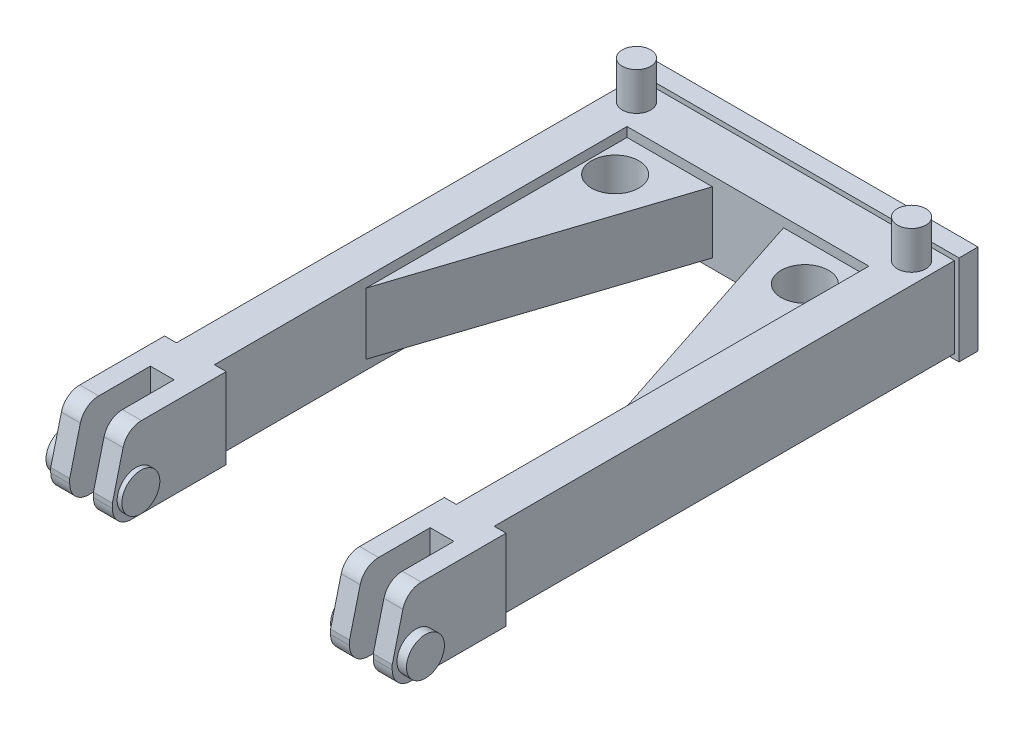
from build123d import *
from OCP.BRepFilletAPI import BRepFilletAPI_MakeChamfer

# Parameters (mm, degrees)
BOSS_EXTRUDE1_DEPTH      = 0.85
SKETCH3_R                = 0.5
BOSS_EXTRUDE2_DEPTH      = 0.65
SKETCH4_W                = 6.9
SKETCH4_H                = 1.9
BOSS_EXTRUDE3_DEPTH      = 0.4
FILLET1_R                = 0.4
CHAMFER1_SIZE            = 1.2
CHAMFER1_SIZE2           = 0.3
FILLET2_R                = 0.4
BOSS_EXTRUDE4_DEPTH      = 0.2
BOSS_EXTRUDE4_DEPTH_BACK = 1.4
SKETCH7_R                = 0.4
BOSS_EXTRUDE5_DEPTH      = 0.2
BOSS_EXTRUDE5_DEPTH_BACK = 1.4
SKETCH8_R                = 0.4
SKETCH6_W                = 0.5
SKETCH6_H                = 1.7
CUT_EXTRUDE1_DEPTH       = 11.940292501
SKETCH9_R                = 0.35
BOSS_EXTRUDE6_DEPTH      = 0.1
SKETCH10_R               = 0.3
BOSS_EXTRUDE7_DEPTH      = 0.8
SCALE1_SCALE             = 2


with BuildPart() as part:
    # Sketch1 → Boss-Extrude1 (new, symmetric)
    with BuildSketch(Plane(origin=(0, 0, 0), x_dir=(1, 0, 0), z_dir=(0, 1, 0))):
        Polygon((-3.35, 0), (-3.35, 10.1), (3.35, 10.1), (3.35, 0), (3.6, 0), (3.6, -2.4), (2.3, -2.4), (2.3, 0), (2.55, 0), (2.55, 8.7), (-2.55, 8.7), (-2.55, 0), (-2.3, 0), (-2.3, -2.4), (-3.6, -2.4), (-3.6, 0), align=None)
    extrude(amount=BOSS_EXTRUDE1_DEPTH, both=True)

    # Sketch3 → Boss-Extrude2 (add, symmetric)
    # profile 1 of 2: a face of its own
    with BuildSketch(Plane(origin=(0, 0, 0), x_dir=(1, 0, 0), z_dir=(0, 1, 0))):
        Polygon((-0.75, 8.7), (-2.55, 8.7), (-2.55, 3.2), align=None)
        with Locations((-2, 7.9)):
            Circle(SKETCH3_R, mode=Mode.SUBTRACT)
    # profile 2 of 2: a face of its own
    with BuildSketch(Plane(origin=(0, 0, 0), x_dir=(1, 0, 0), z_dir=(0, 1, 0))):
        Polygon((2.55, 3.2), (0.75, 8.7), (2.55, 8.7), align=None)
        with Locations((2, 7.9)):
            Circle(SKETCH3_R, mode=Mode.SUBTRACT)
    extrude(amount=BOSS_EXTRUDE2_DEPTH, both=True)

    # Sketch4 → Boss-Extrude3 (add)
    with BuildSketch(Plane(origin=(0, 0, -10.1), x_dir=(-1, 0, 0), z_dir=(0, 0, -1))):
        Rectangle(SKETCH4_W, SKETCH4_H)
    extrude(amount=-BOSS_EXTRUDE3_DEPTH)

    # Fillet1
    fillet1_edges = [part.edges().sort_by_distance(p)[0] for p in [
        (2.95, -0.85, 2.4),
        (-2.95, -0.85, 2.4),
    ]]
    fillet(fillet1_edges, radius=FILLET1_R)

    # Chamfer1: one chamfer whose edges measure the first distance from different faces: ONE call of the kernel's chamfer builder (chamfer() names one face for all edges)
    chamfer1_edges_1 = [part.edges().sort_by_distance(p)[0] for p in [
        (2.95, 0.85, 2.4),
    ]]
    chamfer1_side_1 = [part.faces().sort_by_distance(p)[0] for p in [
        (2.95, 0.2, 2.4),
    ]]
    chamfer1_edges_2 = [part.edges().sort_by_distance(p)[0] for p in [
        (-2.95, 0.85, 2.4),
    ]]
    chamfer1_side_2 = [part.faces().sort_by_distance(p)[0] for p in [
        (-2.95, 0.2, 2.4),
    ]]
    chamfer1 = BRepFilletAPI_MakeChamfer(part.part.solid().wrapped)
    for e in chamfer1_edges_1:
        chamfer1.Add(CHAMFER1_SIZE, CHAMFER1_SIZE2, e.wrapped, chamfer1_side_1[0].wrapped)  # the first distance lies on this face
    for e in chamfer1_edges_2:
        chamfer1.Add(CHAMFER1_SIZE, CHAMFER1_SIZE2, e.wrapped, chamfer1_side_2[0].wrapped)  # the first distance lies on this face
    add(Compound.cast(chamfer1.Shape()), mode=Mode.REPLACE)

    # Fillet2
    fillet2_edges = [part.edges().sort_by_distance(p)[0] for p in [
        (2.95, 0.85, 2.1),
        (-2.95, 0.85, 2.1),
    ]]
    fillet(fillet2_edges, radius=FILLET2_R)

    # Sketch7 → Boss-Extrude4 (add, two sides: drawn at the far end of the back side and taken through both)
    with BuildSketch(Plane.ZY.offset(3.6).offset(-BOSS_EXTRUDE4_DEPTH_BACK)):
        with Locations((1.9, -0.35)):
            Circle(SKETCH7_R)
    extrude(amount=BOSS_EXTRUDE4_DEPTH + BOSS_EXTRUDE4_DEPTH_BACK)

    # Sketch8 → Boss-Extrude5 (add, two sides: drawn at the far end of the back side and taken through both)
    with BuildSketch(Plane(origin=(3.6, 0, 0), x_dir=(0, 0, -1), z_dir=(1, 0, 0)).offset(-BOSS_EXTRUDE5_DEPTH_BACK)):
        with Locations((-1.9, -0.35)):
            Circle(SKETCH8_R)
    extrude(amount=BOSS_EXTRUDE5_DEPTH + BOSS_EXTRUDE5_DEPTH_BACK)

    # Sketch6 → Cut-Extrude1 (cut, through all)
    with BuildSketch(Plane(origin=(0, 0.85, 0), x_dir=(1, 0, 0), z_dir=(0, 1, 0))):
        with Locations((-2.95, -1.55)):
            Rectangle(SKETCH6_W, SKETCH6_H)
        with Locations((2.95, -1.55)):
            Rectangle(SKETCH6_W, SKETCH6_H)
    extrude(amount=-CUT_EXTRUDE1_DEPTH, mode=Mode.SUBTRACT)

    # Sketch9 → Boss-Extrude6 (add)
    with BuildSketch(Plane.XZ.offset(0.85)):
        with Locations((-2.9, -9.25)):
            Circle(SKETCH9_R)
        with Locations((2.9, -9.25)):
            Circle(SKETCH9_R)
    extrude(amount=BOSS_EXTRUDE6_DEPTH)

    # Sketch10 → Boss-Extrude7 (add)
    with BuildSketch(Plane(origin=(0, 0.85, 0), x_dir=(1, 0, 0), z_dir=(0, 1, 0))):
        with Locations((-2.9, 9.25)):
            Circle(SKETCH10_R)
        with Locations((2.9, 9.25)):
            Circle(SKETCH10_R)
    extrude(amount=BOSS_EXTRUDE7_DEPTH)


with BuildPart() as part_1:
    # Scale1: scaled about (0, 0, 0)
    add(part.part.scale(SCALE1_SCALE))


solid = part_1.part
